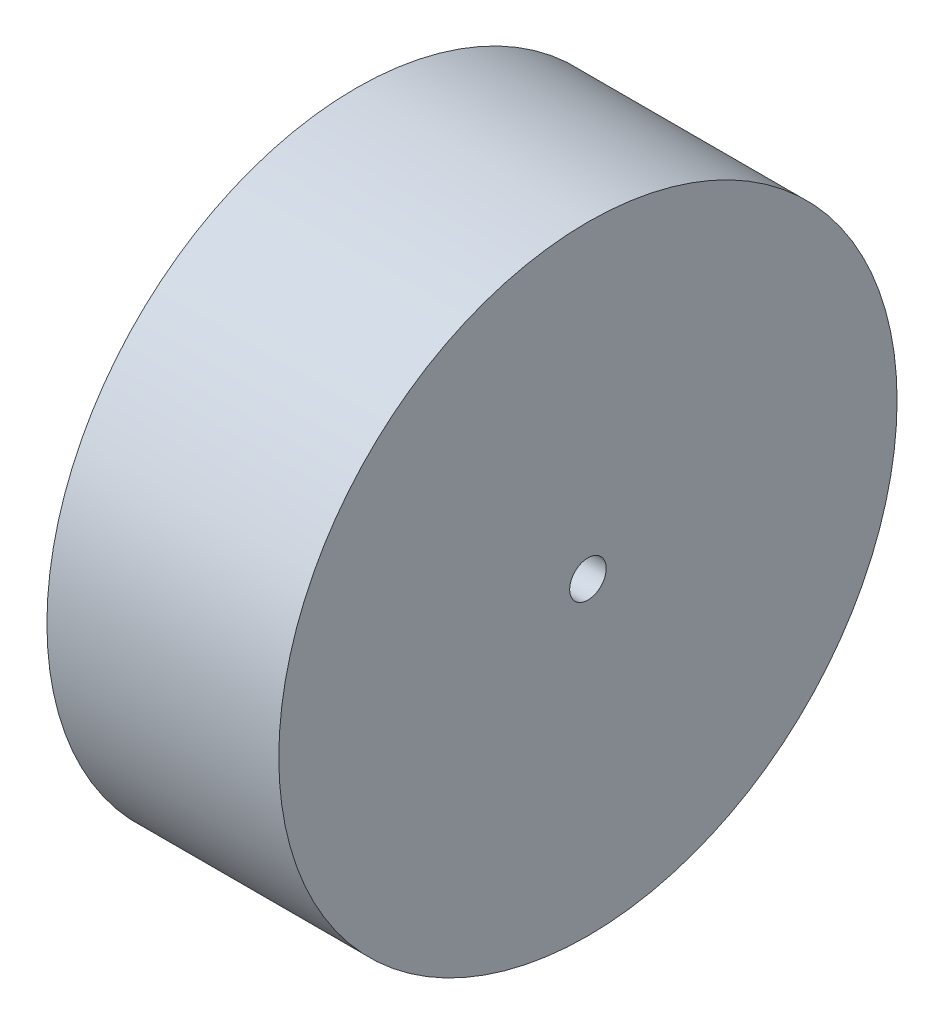
from build123d import *

# Parameters (mm, degrees)
SKETCH1_R           = 25.4
SKETCH1_R_2         = 1.5
BOSS_EXTRUDE2_DEPTH = 19.05


with BuildPart() as part:
    # Sketch1 → Boss-Extrude2 (new body)
    with BuildSketch(Plane(origin=(0, 0, 0), x_dir=(0, 0, -1), z_dir=(1, 0, 0))):
        with Locations(Location((0, 0, 0), (0, 0, 180))):
            Circle(SKETCH1_R)
        with Locations(Location((0, 0, 0), (0, 0, 180))):
            Circle(SKETCH1_R_2, mode=Mode.SUBTRACT)
    extrude(amount=BOSS_EXTRUDE2_DEPTH)


solid = part.part
